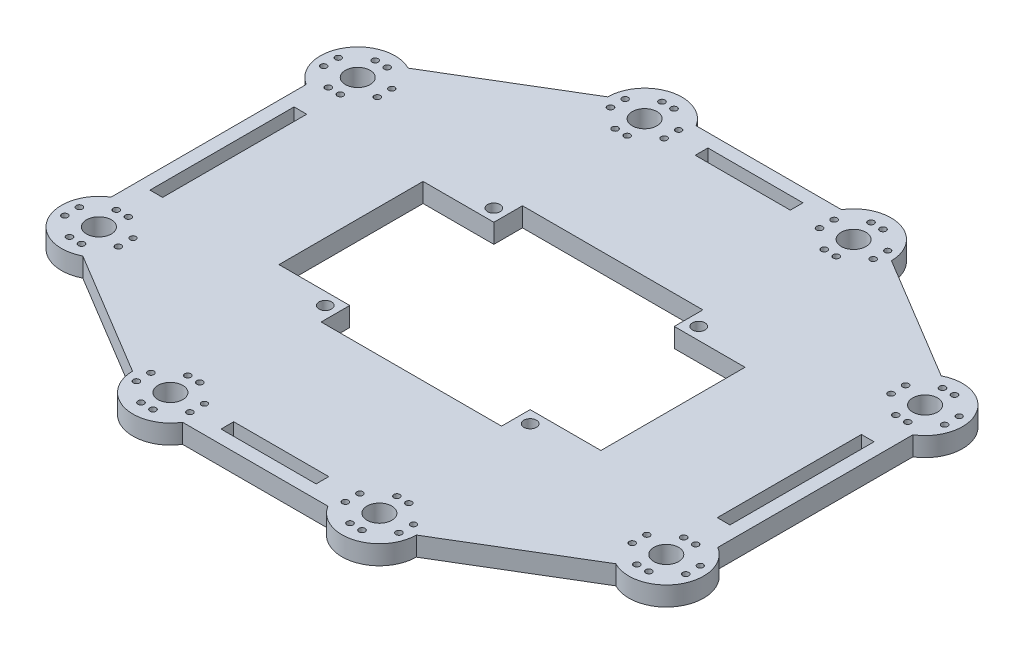
from build123d import *

# Parameters (mm, degrees)
SKETCH1_R           = 9.30275
BOSS_EXTRUDE1_DEPTH = 4.7625
SKETCH1_6_R         = 0.762
SKETCH1_6_R_2       = 0.734114047
SKETCH1_6_W         = 3.1496
SKETCH1_6_H         = 35.814
SKETCH1_6_W_2       = 23.622
SKETCH1_6_H_2       = 3.1496
SKETCH1_6_R_3       = 3.07975
SKETCH1_6_R_4       = 1.55575
CUT_EXTRUDE2_DEPTH  = 4.7625


with BuildPart() as part:
    # Sketch1 → Boss-Extrude1 (new body)
    with BuildSketch(Plane(origin=(0, 0, 0), x_dir=(1, 0, 0), z_dir=(0, 1, 0))):
        with Locations((25.9715, -58.92165)):
            Circle(SKETCH1_R)
        with Locations((-70.4977, 32.16275)):
            Circle(SKETCH1_R)
        with Locations((-70.4977, -32.16275)):
            Circle(SKETCH1_R)
        with Locations((70.4977, 32.16275)):
            Circle(SKETCH1_R)
        with Locations((70.4977, -32.16275)):
            Circle(SKETCH1_R)
        with Locations((25.9715, 58.92165)):
            Circle(SKETCH1_R)
        with Locations((-25.9715, 58.92165)):
            Circle(SKETCH1_R)
        with Locations((-25.9715, -58.92165)):
            Circle(SKETCH1_R)
        Polygon((-75.3872, 32.16275), (-75.3872, -32.16275), (-73.016314747, -36.353667562), (-28.490114747, -63.112567562), (-25.9715, -63.81115), (25.9715, -63.81115), (28.490114747, -63.112567562), (73.016314747, -36.353667562), (75.3872, -32.16275), (75.3872, 32.16275), (73.016314747, 36.353667562), (28.490114747, 63.112567562), (25.9715, 63.81115), (-25.9715, 63.81115), (-28.490114747, 63.112567562), (-73.016314747, 36.353667562), align=None)
    extrude(amount=BOSS_EXTRUDE1_DEPTH)

    # Sketch1<6> → Cut-Extrude2 (cut, symmetric)
    with BuildSketch(Plane(origin=(0, 0, 0), x_dir=(1, 0, 0), z_dir=(0, 1, 0))):
        with Locations((-69.00545, 37.97935)):
            Circle(SKETCH1_6_R)
        with Locations((-69.00545, -37.97935)):
            Circle(SKETCH1_6_R)
        with Locations((-32.6263, 60.7314)):
            Circle(SKETCH1_6_R)
        with Locations((-32.6263, -60.7314)):
            Circle(SKETCH1_6_R)
        with Locations((32.6263, 60.7314)):
            Circle(SKETCH1_6_R_2)
        with Locations((32.6263, -60.7314)):
            Circle(SKETCH1_6_R)
        with Locations((69.00545, 37.97935)):
            Circle(SKETCH1_6_R)
        with Locations((69.00545, -37.97935)):
            Circle(SKETCH1_6_R)
        Polygon((-22.4155, 17.907), (-40.005, 17.907), (-40.005, -17.907), (-22.4155, -17.907), (-22.4155, -25.019), (22.4155, -25.019), (22.4155, -17.907), (40.005, -17.907), (40.005, 17.907), (22.4155, 17.907), (22.4155, 25.019), (-22.4155, 25.019), align=None)
        with Locations((-70.4977, 0)):
            Rectangle(SKETCH1_6_W, SKETCH1_6_H)
        with Locations((70.4977, 0)):
            Rectangle(SKETCH1_6_W, SKETCH1_6_H)
        with Locations((0, -58.92165)):
            Rectangle(SKETCH1_6_W_2, SKETCH1_6_H_2)
        with Locations((0, 58.92165)):
            Rectangle(SKETCH1_6_W_2, SKETCH1_6_H_2)
        with Locations((25.9715, -58.92165)):
            Circle(SKETCH1_6_R_3)
        with Locations((27.46375, -53.10505)):
            Circle(SKETCH1_6_R)
        with Locations((24.47925, -53.10505)):
            Circle(SKETCH1_6_R)
        with Locations((24.47925, -64.73825)):
            Circle(SKETCH1_6_R)
        with Locations((27.46375, -64.73825)):
            Circle(SKETCH1_6_R)
        with Locations((19.3167, -57.1119)):
            Circle(SKETCH1_6_R)
        with Locations((19.3167, -60.7314)):
            Circle(SKETCH1_6_R)
        with Locations((32.6263, -57.1119)):
            Circle(SKETCH1_6_R_2)
        with Locations((-63.8429, 30.353)):
            Circle(SKETCH1_6_R)
        with Locations((-77.1525, 30.353)):
            Circle(SKETCH1_6_R)
        with Locations((-71.98995, 26.34615)):
            Circle(SKETCH1_6_R)
        with Locations((-77.1525, 33.9725)):
            Circle(SKETCH1_6_R)
        with Locations((-70.4977, 32.16275)):
            Circle(SKETCH1_6_R_3)
        with Locations((-69.00545, 26.34615)):
            Circle(SKETCH1_6_R)
        with Locations((-71.98995, 37.97935)):
            Circle(SKETCH1_6_R)
        with Locations((-63.8429, 33.9725)):
            Circle(SKETCH1_6_R_2)
        with Locations((-70.4977, -32.16275)):
            Circle(SKETCH1_6_R_3)
        with Locations((-69.00545, -26.34615)):
            Circle(SKETCH1_6_R)
        with Locations((-71.98995, -26.34615)):
            Circle(SKETCH1_6_R)
        with Locations((-71.98995, -37.97935)):
            Circle(SKETCH1_6_R)
        with Locations((-77.1525, -30.353)):
            Circle(SKETCH1_6_R)
        with Locations((-77.1525, -33.9725)):
            Circle(SKETCH1_6_R)
        with Locations((-63.8429, -30.353)):
            Circle(SKETCH1_6_R_2)
        with Locations((-63.8429, -33.9725)):
            Circle(SKETCH1_6_R)
        with Locations((70.4977, 32.16275)):
            Circle(SKETCH1_6_R_3)
        with Locations((71.98995, 37.97935)):
            Circle(SKETCH1_6_R)
        with Locations((69.00545, 26.34615)):
            Circle(SKETCH1_6_R)
        with Locations((71.98995, 26.34615)):
            Circle(SKETCH1_6_R)
        with Locations((63.8429, 33.9725)):
            Circle(SKETCH1_6_R)
        with Locations((63.8429, 30.353)):
            Circle(SKETCH1_6_R)
        with Locations((77.1525, 33.9725)):
            Circle(SKETCH1_6_R_2)
        with Locations((77.1525, 30.353)):
            Circle(SKETCH1_6_R)
        with Locations((70.4977, -32.16275)):
            Circle(SKETCH1_6_R_3)
        with Locations((71.98995, -26.34615)):
            Circle(SKETCH1_6_R)
        with Locations((69.00545, -26.34615)):
            Circle(SKETCH1_6_R)
        with Locations((71.98995, -37.97935)):
            Circle(SKETCH1_6_R)
        with Locations((63.8429, -30.353)):
            Circle(SKETCH1_6_R)
        with Locations((63.8429, -33.9725)):
            Circle(SKETCH1_6_R)
        with Locations((77.1525, -30.353)):
            Circle(SKETCH1_6_R_2)
        with Locations((77.1525, -33.9725)):
            Circle(SKETCH1_6_R)
        with Locations((25.9715, 58.92165)):
            Circle(SKETCH1_6_R_3)
        with Locations((27.46375, 64.73825)):
            Circle(SKETCH1_6_R)
        with Locations((24.47925, 64.73825)):
            Circle(SKETCH1_6_R)
        with Locations((24.47925, 53.10505)):
            Circle(SKETCH1_6_R)
        with Locations((27.46375, 53.10505)):
            Circle(SKETCH1_6_R)
        with Locations((19.3167, 60.7314)):
            Circle(SKETCH1_6_R)
        with Locations((19.3167, 57.1119)):
            Circle(SKETCH1_6_R)
        with Locations((32.6263, 57.1119)):
            Circle(SKETCH1_6_R)
        with Locations((-25.9715, 58.92165)):
            Circle(SKETCH1_6_R_3)
        with Locations((-24.47925, 64.73825)):
            Circle(SKETCH1_6_R)
        with Locations((-27.46375, 64.73825)):
            Circle(SKETCH1_6_R)
        with Locations((-27.46375, 53.10505)):
            Circle(SKETCH1_6_R)
        with Locations((-24.47925, 53.10505)):
            Circle(SKETCH1_6_R)
        with Locations((-32.6263, 57.1119)):
            Circle(SKETCH1_6_R)
        with Locations((-19.3167, 60.7314)):
            Circle(SKETCH1_6_R_2)
        with Locations((-19.3167, 57.1119)):
            Circle(SKETCH1_6_R)
        with Locations((-25.9715, -58.92165)):
            Circle(SKETCH1_6_R_3)
        with Locations((-24.47925, -53.10505)):
            Circle(SKETCH1_6_R)
        with Locations((-27.46375, -53.10505)):
            Circle(SKETCH1_6_R)
        with Locations((-27.46375, -64.73825)):
            Circle(SKETCH1_6_R)
        with Locations((-24.47925, -64.73825)):
            Circle(SKETCH1_6_R)
        with Locations((-32.6263, -57.1119)):
            Circle(SKETCH1_6_R)
        with Locations((-19.3167, -57.1119)):
            Circle(SKETCH1_6_R_2)
        with Locations((-19.3167, -60.7314)):
            Circle(SKETCH1_6_R)
        with Locations((-25.45715, 20.94865)):
            Circle(SKETCH1_6_R_4)
        with Locations((25.45715, 20.94865)):
            Circle(SKETCH1_6_R_4)
        with Locations((25.45715, -20.94865)):
            Circle(SKETCH1_6_R_4)
        with Locations((-25.45715, -20.94865)):
            Circle(SKETCH1_6_R_4)
    extrude(amount=CUT_EXTRUDE2_DEPTH, both=True, mode=Mode.SUBTRACT)


solid = part.part
